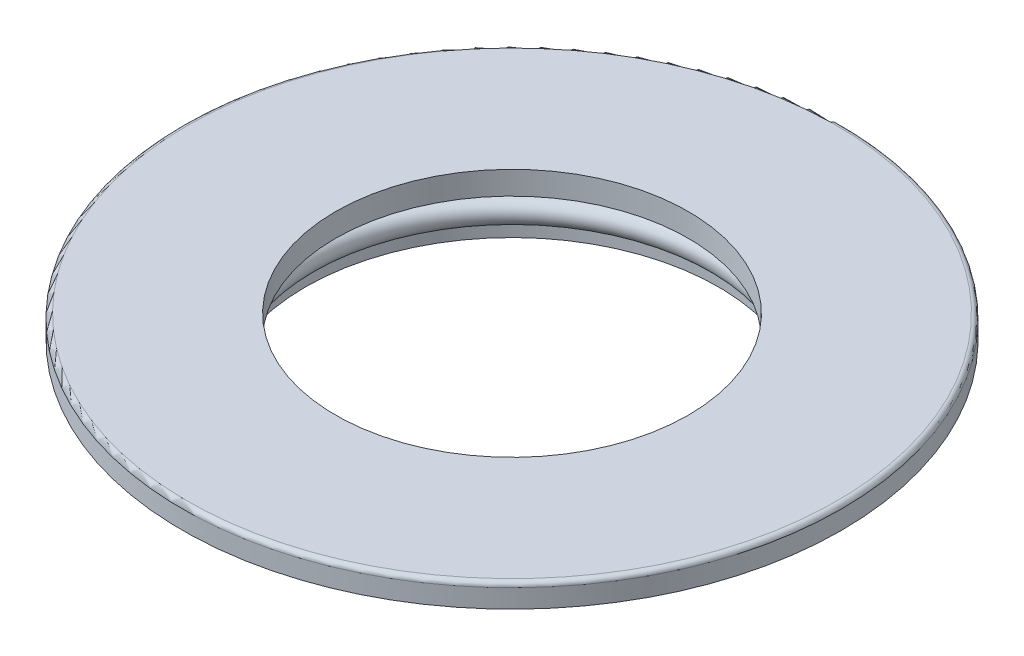
from build123d import *


with BuildPart() as part:
    # Sketch1 → Revolve1 (revolve)
    with BuildSketch(Plane.XY):
        with BuildLine():
            Line((26.42831399, 12.330127019), (26.42831399, 16.330127019))
            ThreePointArc((26.42831399, 16.330127019), (26.721207209, 17.0372338), (27.42831399, 17.330127019))
            Line((27.42831399, 17.330127019), (59.42831399, 17.330127019))
            Line((59.42831399, 17.330127019), (59.42831399, 12.330127019))
            Line((59.42831399, 12.330127019), (55.42831399, 12.330127019))
            ThreePointArc((55.42831399, 12.330127019), (53.660547037, 11.597893972), (52.92831399, 9.830127019))
            Line((52.92831399, 9.830127019), (52.92831399, 8))
            ThreePointArc((52.92831399, 8), (55.42831399, 5.5), (52.92831399, 3))
            Line((52.92831399, 3), (52.92831399, 0))
            Line((52.92831399, 0), (47.92831399, 0))
            Line((47.92831399, 0), (47.92831399, 7.330127019))
            ThreePointArc((47.92831399, 7.330127019), (46.463847896, 10.865660925), (42.92831399, 12.330127019))
            Line((42.92831399, 12.330127019), (26.42831399, 12.330127019))
        make_face()
    revolve(axis=Axis((97.42831399, 39.892585804, 0), (0, -1, 0)))


solid = part.part
